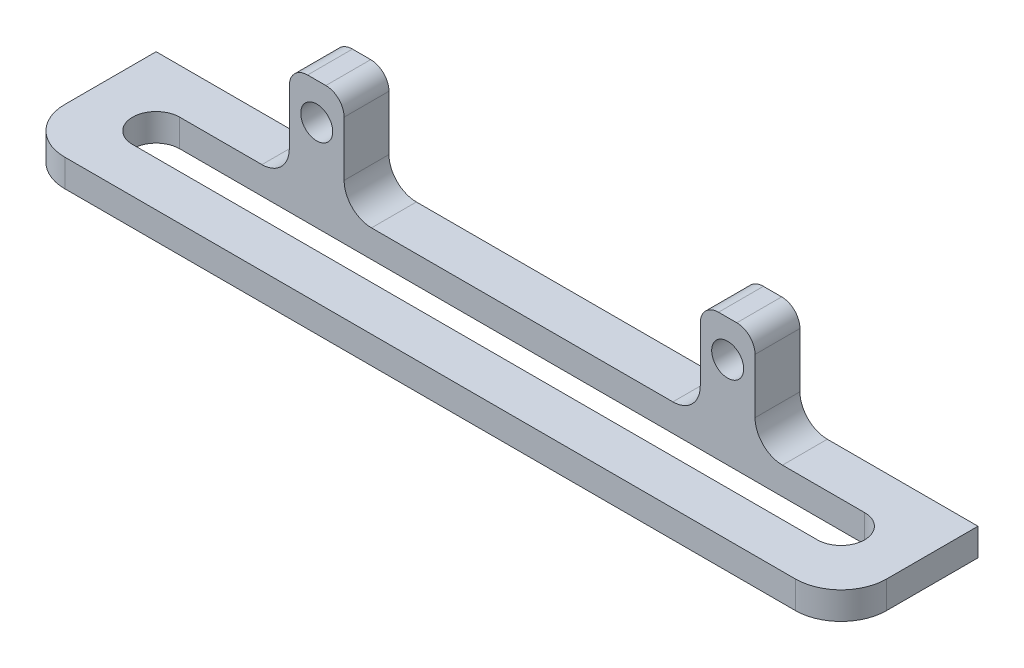
from build123d import *

# Parameters (mm, degrees)
SKETCH1_W           = 90
SKETCH1_H           = 15
BOSS_EXTRUDE1_DEPTH = 3
FILLET1_R           = 5
SKETCH2_W           = 6
SKETCH2_H           = 4.913709841
BOSS_EXTRUDE2_DEPTH = 11
SKETCH3_R           = 1.75
CUT_EXTRUDE1_DEPTH  = 4.913709841
FILLET2_R           = 2
FILLET3_R           = 3


with BuildPart() as part:
    # Sketch1 → Boss-Extrude1 (new body)
    with BuildSketch(Plane(origin=(0, 0, 0), x_dir=(1, 0, 0), z_dir=(0, 1, 0))):
        Rectangle(SKETCH1_W, SKETCH1_H)
        with BuildLine():
            Line((-37.5, 2.586290159), (37.5, 2.586290159))
            ThreePointArc((37.5, 2.586290159), (40.086290159, 0), (37.5, -2.586290159))
            Line((37.5, -2.586290159), (-37.5, -2.586290159))
            ThreePointArc((-37.5, -2.586290159), (-40.086290159, 0), (-37.5, 2.586290159))
        make_face(mode=Mode.SUBTRACT)
    extrude(amount=BOSS_EXTRUDE1_DEPTH)

    # Fillet1
    fillet1_edges = [part.edges().sort_by_distance(p)[0] for p in [
        (45, 1.5, 7.5),
        (-45, 1.5, 7.5),
    ]]
    fillet(fillet1_edges, radius=FILLET1_R)

    # Sketch2 → Boss-Extrude2 (add)
    with BuildSketch(Plane(origin=(0, 3, 0), x_dir=(1, 0, 0), z_dir=(0, 1, 0))):
        with Locations((-22.5, 5.04314508)):
            Rectangle(SKETCH2_W, SKETCH2_H)
        with Locations((22.5, 5.04314508)):
            Rectangle(SKETCH2_W, SKETCH2_H)
    extrude(amount=BOSS_EXTRUDE2_DEPTH)

    # Sketch3 → Cut-Extrude1 (cut)
    with BuildSketch(Plane.XY.offset(-2.586290159)):
        with Locations((-22.5, 10)):
            Circle(SKETCH3_R)
    cut_extrude1 = extrude(amount=-CUT_EXTRUDE1_DEPTH, mode=Mode.SUBTRACT)

    # Mirror1: Cut-Extrude1 across plane
    add(cut_extrude1.mirror(Plane(origin=(0, 0, 0), x_dir=(0, 0, 1), z_dir=(1, 0, 0))), mode=Mode.SUBTRACT)

    # Fillet2
    fillet2_edges = [part.edges().sort_by_distance(p)[0] for p in [
        (-25.5, 14, -5.043145079),
        (-19.5, 14, -5.043145079),
        (19.5, 14, -5.043145079),
        (25.5, 14, -5.043145079),
    ]]
    fillet(fillet2_edges, radius=FILLET2_R)

    # Fillet3
    fillet3_edges = [part.edges().sort_by_distance(p)[0] for p in [
        (-25.5, 3, -5.043145079),
        (-19.5, 3, -5.043145079),
        (19.5, 3, -5.043145079),
        (25.5, 3, -5.043145079),
    ]]
    fillet(fillet3_edges, radius=FILLET3_R)


solid = part.part
